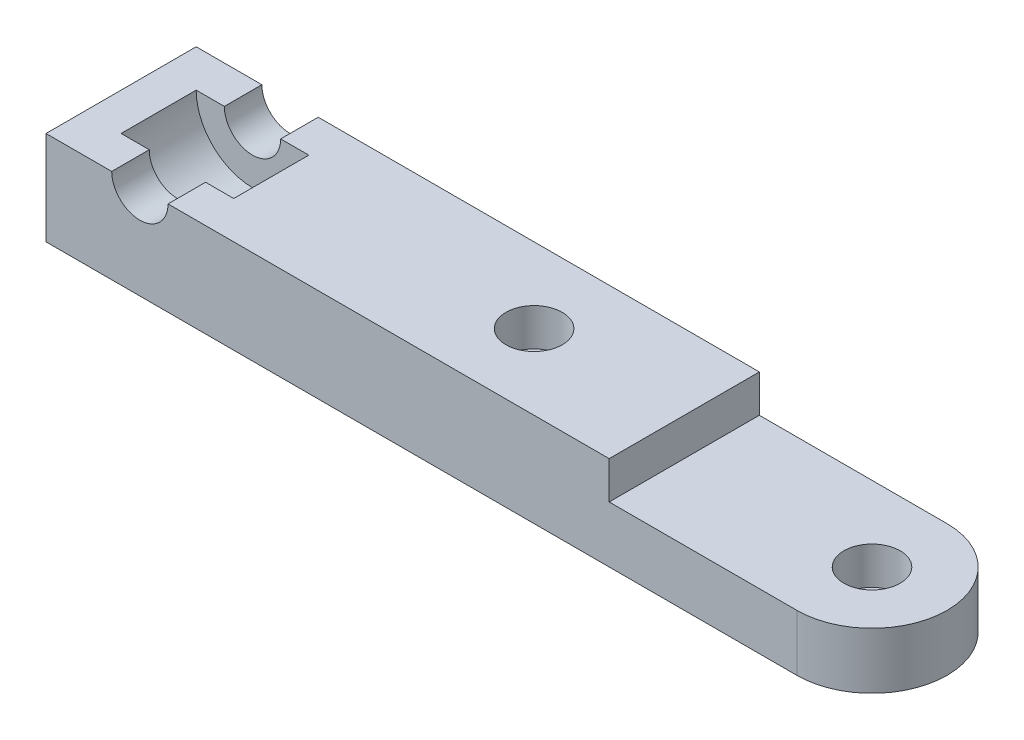
from build123d import *

# Parameters (mm, degrees)
BOSS_EXTRUDE2_DEPTH     = 3
SKETCH3_W               = 30
SKETCH3_H               = 8
BOSS_EXTRUDE3_DEPTH     = 2
CUT_EXTRUDE1_DEPTH      = 70.641941386
CUT_EXTRUDE2_DEPTH      = 2
CUT_EXTRUDE2_DEPTH_BACK = 2
SKETCH4_R               = 1.5
CUT_EXTRUDE3_DEPTH      = 2
SKETCH12_R              = 1.5
CUT_EXTRUDE4_DEPTH      = 2


with BuildPart() as part:
    # Sketch1 → Boss-Extrude2 (new body)
    with BuildSketch(Plane(origin=(0, 0, 0), x_dir=(1, 0, 0), z_dir=(0, 1, 0))):
        with BuildLine():
            Line((25, -4), (65, -4))
            ThreePointArc((65, -4), (69, 0), (65, 4))
            Line((65, 4), (25, 4))
            Line((25, 4), (25, -4))
        make_face()
    extrude(amount=BOSS_EXTRUDE2_DEPTH)

    # Sketch3 → Boss-Extrude3 (add)
    with BuildSketch(Plane(origin=(0, 3, 0), x_dir=(1, 0, 0), z_dir=(0, 1, 0))):
        with Locations((40, 0)):
            Rectangle(SKETCH3_W, SKETCH3_H)
    extrude(amount=BOSS_EXTRUDE3_DEPTH)

    # Sketch13 → Cut-Extrude1 (cut, through all)
    with BuildSketch(Plane.XY.offset(4)):
        with BuildLine():
            Line((31.5, 5), (28.5, 5))
            ThreePointArc((28.5, 5), (30, 3.5), (31.5, 5))
        make_face()
    extrude(amount=-CUT_EXTRUDE1_DEPTH, mode=Mode.SUBTRACT)

    # Sketch14 → Cut-Extrude2 (cut, two sides: drawn at the far end of the back side and taken through both)
    with BuildSketch(Plane.XY.offset(-CUT_EXTRUDE2_DEPTH_BACK)):
        with BuildLine():
            Line((27, 5), (33, 5))
            ThreePointArc((33, 5), (30, 2), (27, 5))
        make_face()
    extrude(amount=CUT_EXTRUDE2_DEPTH + CUT_EXTRUDE2_DEPTH_BACK, mode=Mode.SUBTRACT)

    # Sketch4 → Cut-Extrude3 (cut)
    with BuildSketch(Plane(origin=(0, 3, 0), x_dir=(1, 0, 0), z_dir=(0, 1, 0))):
        with Locations(Location((65, 0, 0), (0, 0, 270))):
            Circle(SKETCH4_R)
    extrude(amount=-CUT_EXTRUDE3_DEPTH, mode=Mode.SUBTRACT)

    # Sketch12 → Cut-Extrude4 (cut)
    with BuildSketch(Plane(origin=(0, 5, 0), x_dir=(1, 0, 0), z_dir=(0, 1, 0))):
        with Locations(Location((47, 0, 0), (0, 0, 270))):
            Circle(SKETCH12_R)
    extrude(amount=-CUT_EXTRUDE4_DEPTH, mode=Mode.SUBTRACT)


solid = part.part
